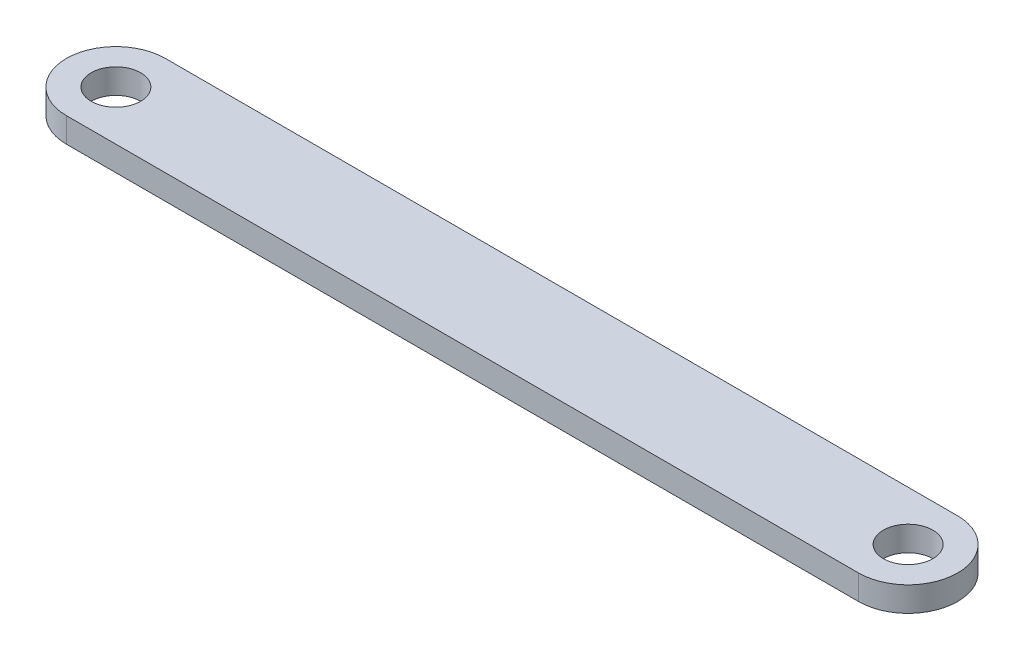
from build123d import *

# Parameters (mm, degrees)
SKETCH1_R           = 5
BOSS_EXTRUDE1_DEPTH = 5


with BuildPart() as part:
    # Sketch1 → Boss-Extrude1 (new body)
    with BuildSketch(Plane(origin=(0, 0, 0), x_dir=(1, 0, 0), z_dir=(0, 1, 0))):
        with BuildLine():
            Line((-80, 10), (80, 10))
            ThreePointArc((80, 10), (90, 0), (80, -10))
            Line((80, -10), (-80, -10))
            ThreePointArc((-80, -10), (-90, 0), (-80, 10))
        make_face()
        with Locations(Location((-80, 0, 0), (0, 0, 270))):
            Circle(SKETCH1_R, mode=Mode.SUBTRACT)
        with Locations(Location((80, 0, 0), (0, 0, 270))):
            Circle(SKETCH1_R, mode=Mode.SUBTRACT)
    extrude(amount=BOSS_EXTRUDE1_DEPTH)


solid = part.part
